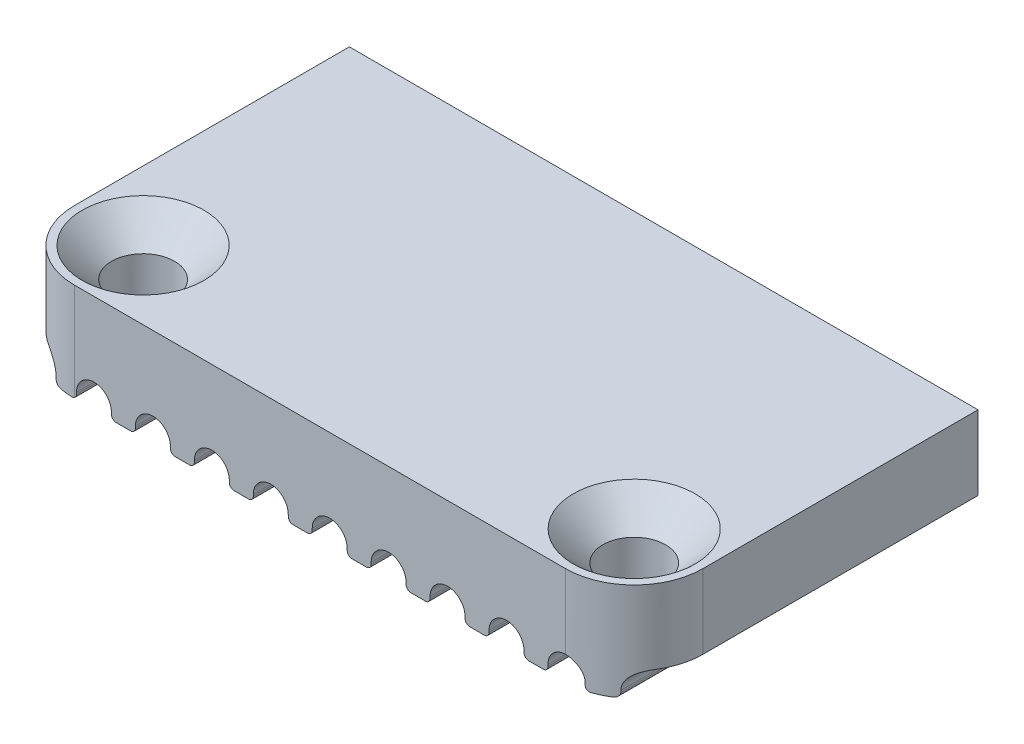
from build123d import *

# Parameters (mm, degrees)
SKETCH_1_W             = 32
SKETCH_1_H             = 5
EXTRUDE_1_DEPTH        = 8.75
CUT_EXTRUDE_1_DEPTH    = 24.843238035
PATTERN_LINEAR_1_COUNT = 11
PATTERN_LINEAR_1_PITCH = 3
SKETCH_3_W             = 1.5
SKETCH_3_H             = 1.22
SKETCH_3_W_2           = 0.5
CUT_EXTRUDE_2_DEPTH    = 24.843238035
SKETCH_4_R             = 1.6
CUT_EXTRUDE_3_DEPTH    = 19.909323097
CHAMFER_1_SIZE         = 1.5
FILLET_1_R             = 3.5


with BuildPart() as part:
    # 草图1 → 凸台-拉伸1 (new, symmetric)
    with BuildSketch(Plane.XY):
        Rectangle(SKETCH_1_W, SKETCH_1_H)
    extrude(amount=EXTRUDE_1_DEPTH, both=True)

    # 草图2 → 切除-拉伸1 (cut, through all)
    with BuildSketch(Plane.XY.offset(8.75)):
        with BuildLine():
            Line((-16, -2.5), (-15.63, -2.5))
            ThreePointArc((-15.63, -2.5), (-15.460294373, -2.429705627), (-15.39, -2.26))
            Line((-15.39, -2.26), (-15.39, -2.17))
            ThreePointArc((-15.39, -2.17), (-14.5, -1.28), (-13.61, -2.17))
            Line((-13.61, -2.17), (-13.61, -2.26))
            ThreePointArc((-13.61, -2.26), (-13.539705627, -2.429705627), (-13.37, -2.5))
            Line((-13.37, -2.5), (-13, -2.5))
            Line((-13, -2.5), (-13, -3.5))
            Line((-13, -3.5), (-16, -3.5))
            Line((-16, -3.5), (-16, -2.5))
        make_face()
    cut_extrude_1 = extrude(amount=-CUT_EXTRUDE_1_DEPTH, mode=Mode.SUBTRACT)

    # 阵列(线性)1: 切除-拉伸1 ×11
    with Locations(*[(i * PATTERN_LINEAR_1_PITCH, 0, 0) for i in range(1, PATTERN_LINEAR_1_COUNT)]):
        add(cut_extrude_1, mode=Mode.SUBTRACT)

    # 草图3 → 切除-拉伸2 (cut, through all)
    with BuildSketch(Plane.XY.offset(8.75)):
        with Locations((-15.25, -1.89)):
            Rectangle(SKETCH_3_W, SKETCH_3_H)
        with Locations((15.75, -1.89)):
            Rectangle(SKETCH_3_W_2, SKETCH_3_H)
    extrude(amount=-CUT_EXTRUDE_2_DEPTH, mode=Mode.SUBTRACT)

    # 草图4 → 切除-拉伸3 (cut, through all)
    with BuildSketch(Plane(origin=(0, 2.5, 0), x_dir=(1, 0, 0), z_dir=(0, 1, 0))):
        with Locations(Location((-12.5, -5.25, 0), (0, 0, 180))):
            Circle(SKETCH_4_R)
        with Locations(Location((12.5, -5.25, 0), (0, 0, 180))):
            Circle(SKETCH_4_R)
    extrude(amount=-CUT_EXTRUDE_3_DEPTH, mode=Mode.SUBTRACT)

    # 倒角1
    chamfer_1_edges = [part.edges().sort_by_distance(p)[0] for p in [
        (-10.9, 2.5, 5.25),
        (14.1, 2.5, 5.25),
    ]]
    chamfer(chamfer_1_edges, length=CHAMFER_1_SIZE)

    # 圆角1
    fillet_1_edges = [part.edges().sort_by_distance(p)[0] for p in [
        (-16, 0.61, 8.75),
        (16, 0.61, 8.75),
    ]]
    fillet(fillet_1_edges, radius=FILLET_1_R)


solid = part.part
